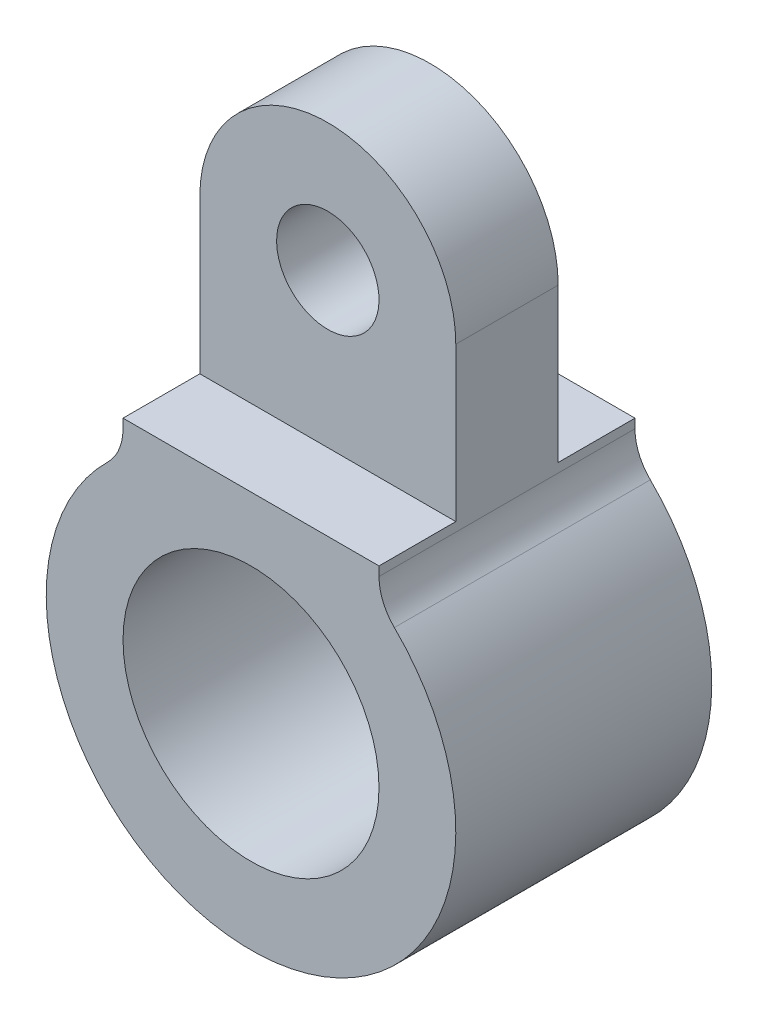
from build123d import *

# Parameters (mm, degrees)
ESQUISSE1_R             = 10
ESQUISSE1_R_2           = 4
BASE_EXTRUSION_DEPTH    = 20
CONG_1_R                = 4
ESQUISSE4_W             = 14
ESQUISSE4_H             = 23
ENL_V_MAT_EXTRU_4_DEPTH = 10


with BuildPart() as part:
    # Esquisse1 → Base-Extrusion (new body)
    with BuildSketch(Plane.XY):
        with BuildLine():
            Line((10, 27), (10, 12.489995997))
            ThreePointArc((10, 12.489995997), (0, -16), (-10, 12.489995997))
            Line((-10, 12.489995997), (-10, 27))
            ThreePointArc((-10, 27), (0, 37), (10, 27))
        make_face()
        Circle(ESQUISSE1_R, mode=Mode.SUBTRACT)
        with Locations((0, 27)):
            Circle(ESQUISSE1_R_2, mode=Mode.SUBTRACT)
    extrude(amount=BASE_EXTRUSION_DEPTH)

    # Congé1
    cong_1_edges = [part.edges().sort_by_distance(p)[0] for p in [
        (10, 12.489995997, 10),
        (-10, 12.489995997, 10),
    ]]
    fillet(cong_1_edges, radius=CONG_1_R)

    # Esquisse4 → Enlèv. mat.-Extru.4 (cut, symmetric)
    with BuildSketch(Plane(origin=(0, 0, 0), x_dir=(0, 0, -1), z_dir=(1, 0, 0))):
        with Locations((-21, 26.5)):
            Rectangle(ESQUISSE4_W, ESQUISSE4_H)
        with Locations((1, 26.5)):
            Rectangle(ESQUISSE4_W, ESQUISSE4_H)
    extrude(amount=ENL_V_MAT_EXTRU_4_DEPTH, both=True, mode=Mode.SUBTRACT)


solid = part.part
